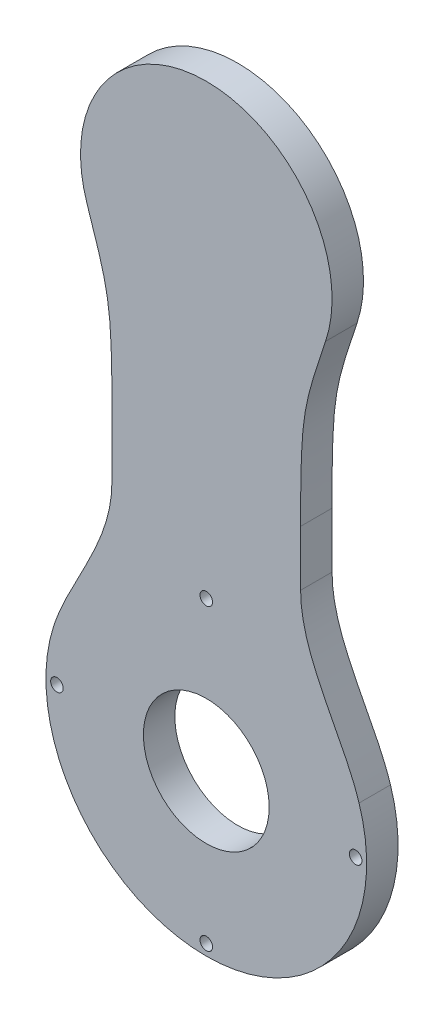
from build123d import *

# Parameters (mm, degrees)
BOSS_EXTRUDE1_DEPTH = 10
SKETCH3_R           = 2
SKETCH3_R_2         = 20
CUT_EXTRUDE1_DEPTH  = 10


with BuildPart() as part:
    # Sketch2 → Boss-Extrude1 (new body)
    with BuildSketch(Plane.XY):
        with BuildLine():
            ThreePointArc((30, 41.243181255), (41.354060385, 29.846971198), (48.593569979, 15.481116133))
            add(Edge.make_bspline(
                [(30, 64.78657274), (30, 46.734360232), (43.458104798, 31.600792807), (48.593569979, 15.481116133)],
                knots=[0, 0, 0, 0, 1, 1, 1, 1], degree=3))
            Line((30, 64.78657274), (30, 41.243181255))
        make_face()
        with BuildLine():
            ThreePointArc((-48.593569979, 15.481116133), (-41.354060385, 29.846971198), (-30, 41.243181255))
            Line((-30, 41.243181255), (-30, 64.78657274))
            add(Edge.make_bspline(
                [(-30, 64.78657274), (-30, 46.734360232), (-43.458104798, 31.600792807), (-48.593569979, 15.481116133)],
                knots=[0, 0, 0, 0, 1, 1, 1, 1], degree=3))
        make_face()
        with BuildLine():
            add(Edge.make_bspline(
                [(-37.932636655, 137.306888623), (-30.736363595, 115.801238579), (-30, 113.598295334), (-30, 82.392834072)],
                knots=[0, 0, 0, 0, 1, 1, 1, 1], degree=3))
            Line((-30, 82.392834072), (-30, 123.542486889))
            ThreePointArc((-30, 123.542486889), (-34.65653574, 130.026904834), (-37.932636655, 137.306888623))
        make_face()
        with BuildLine():
            add(Edge.make_bspline(
                [(37.932636655, 137.306888623), (30.736363595, 115.801238579), (30, 113.598295334), (30, 82.392834072)],
                knots=[0, 0, 0, 0, 1, 1, 1, 1], degree=3))
            ThreePointArc((37.932636655, 137.306888623), (34.65653574, 130.026904834), (30, 123.542486889))
            Line((30, 123.542486889), (30, 82.392834072))
        make_face()
        with BuildLine():
            Line((30, 41.243181255), (30, 123.542486889))
            ThreePointArc((30, 123.542486889), (0, 190), (-30, 123.542486889))
            Line((-30, 123.542486889), (-30, 41.243181255))
            ThreePointArc((-30, 41.243181255), (-45.447772223, 23.140872931), (-51, 0))
            ThreePointArc((-51, 0), (0, -51), (51, 0))
            ThreePointArc((51, 0), (45.447772223, 23.140872931), (30, 41.243181255))
        make_face()
    extrude(amount=BOSS_EXTRUDE1_DEPTH)

    # Sketch3 → Cut-Extrude1 (cut)
    with BuildSketch(Plane.XY.offset(10)):
        with Locations((0, -47.5)):
            Circle(SKETCH3_R)
        with Locations((-47.5, 0)):
            Circle(SKETCH3_R)
        with Locations((0, 47.5)):
            Circle(SKETCH3_R)
        with Locations((47.5, 0)):
            Circle(SKETCH3_R)
        Circle(SKETCH3_R_2)
    extrude(amount=-CUT_EXTRUDE1_DEPTH, mode=Mode.SUBTRACT)


solid = part.part
